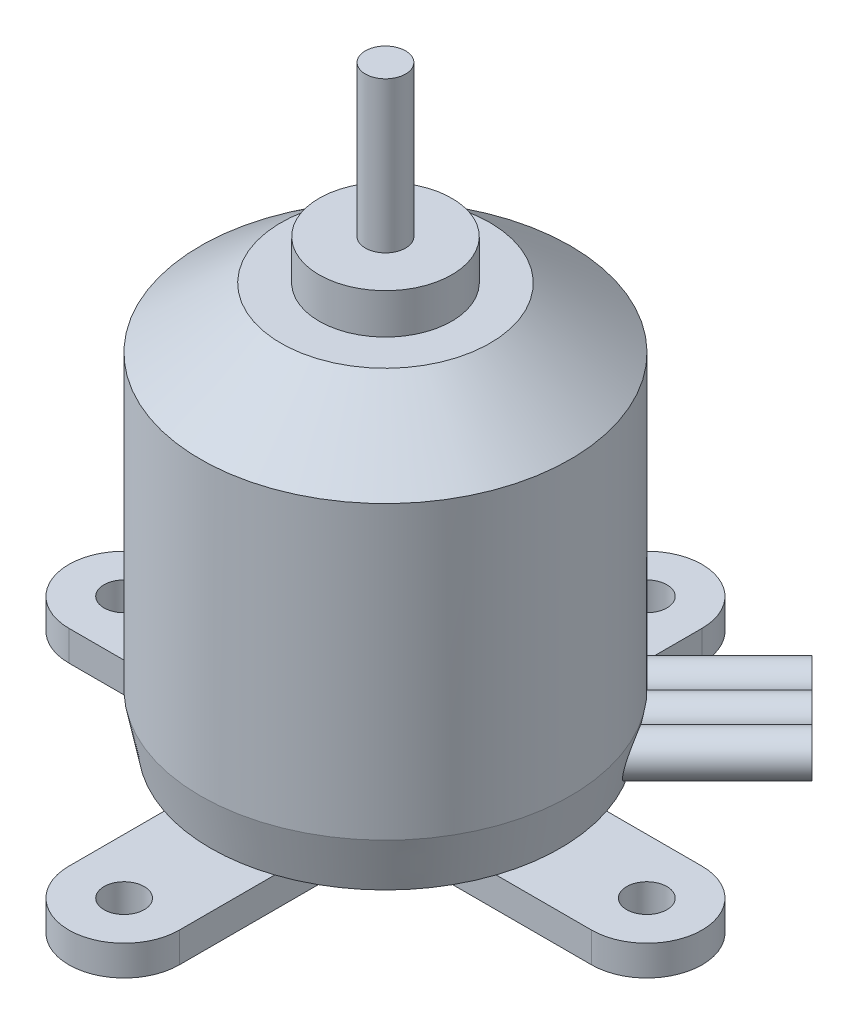
from build123d import *

# Parameters (mm, degrees)
SKETCH1_R           = 9.2
BOSS_EXTRUDE1_DEPTH = 20
CHAMFER1_SIZE       = 3
CHAMFER1_SIZE2      = 4
SKETCH2_R           = 3.3
BOSS_EXTRUDE2_DEPTH = 2
SKETCH3_R           = 1
BOSS_EXTRUDE3_DEPTH = 7.5
CHAMFER2_SIZE       = 0.5
CHAMFER2_SIZE2      = 2.5
SKETCH4_R           = 1
BOSS_EXTRUDE4_DEPTH = 1.5
SKETCH5_R           = 1
BOSS_EXTRUDE5_DEPTH = 15


with BuildPart() as part:
    # Sketch1 → Boss-Extrude1 (new body)
    with BuildSketch(Plane(origin=(0, 0, 0), x_dir=(1, 0, 0), z_dir=(0, 1, 0))):
        with Locations(Location((0, 0, 0), (0, 0, 270))):
            Circle(SKETCH1_R)
    extrude(amount=BOSS_EXTRUDE1_DEPTH)

    # Chamfer1
    chamfer1_edges = [part.edges().sort_by_distance(p)[0] for p in [
        (0, 20, -9.2),
    ]]
    chamfer1_side = [part.faces().sort_by_distance(p)[0] for p in [
        (0, 10, -9.2),
    ]]
    chamfer(chamfer1_edges, length=CHAMFER1_SIZE, length2=CHAMFER1_SIZE2, reference=chamfer1_side[0])

    # Sketch2 → Boss-Extrude2 (add)
    with BuildSketch(Plane(origin=(0, 20, 0), x_dir=(1, 0, 0), z_dir=(0, 1, 0))):
        with Locations(Location((0, 0, 0), (0, 0, 270))):
            Circle(SKETCH2_R)
    extrude(amount=BOSS_EXTRUDE2_DEPTH)

    # Sketch3 → Boss-Extrude3 (add)
    with BuildSketch(Plane(origin=(0, 22, 0), x_dir=(1, 0, 0), z_dir=(0, 1, 0))):
        with Locations(Location((0, 0, 0), (0, 0, 270))):
            Circle(SKETCH3_R)
    extrude(amount=BOSS_EXTRUDE3_DEPTH)

    # Chamfer2
    chamfer2_edges = [part.edges().sort_by_distance(p)[0] for p in [
        (0, 0, -9.2),
    ]]
    chamfer2_side = [part.faces().sort_by_distance(p)[0] for p in [
        (0, 0, 0),
    ]]
    chamfer(chamfer2_edges, length=CHAMFER2_SIZE, length2=CHAMFER2_SIZE2, reference=chamfer2_side[0])

    # Sketch4 → Boss-Extrude4 (add)
    with BuildSketch(Plane.XZ):
        with BuildLine():
            Line((-2.75, 2.75), (-2.75, 13))
            ThreePointArc((-2.75, 13), (0, 15.75), (2.75, 13))
            Line((2.75, 13), (2.75, 2.75))
            Line((2.75, 2.75), (13, 2.75))
            ThreePointArc((13, 2.75), (15.75, 0), (13, -2.75))
            Line((13, -2.75), (2.75, -2.75))
            Line((2.75, -2.75), (2.75, -13))
            ThreePointArc((2.75, -13), (0, -15.75), (-2.75, -13))
            Line((-2.75, -13), (-2.75, -2.75))
            Line((-2.75, -2.75), (-13, -2.75))
            ThreePointArc((-13, -2.75), (-15.75, 0), (-13, 2.75))
            Line((-13, 2.75), (-2.75, 2.75))
        make_face()
        with Locations(Location((0, 13, 0), (0, 0, 270))):
            Circle(SKETCH4_R, mode=Mode.SUBTRACT)
        with Locations(Location((13, 0, 0), (0, 0, 270))):
            Circle(SKETCH4_R, mode=Mode.SUBTRACT)
        with Locations(Location((0, -13, 0), (0, 0, 270))):
            Circle(SKETCH4_R, mode=Mode.SUBTRACT)
        with Locations(Location((-13, 0, 0), (0, 0, 270))):
            Circle(SKETCH4_R, mode=Mode.SUBTRACT)
        with Locations(Location((0, 6.5, 0), (0, 0, 270))):
            Circle(SKETCH4_R, mode=Mode.SUBTRACT)
        with Locations(Location((6.5, 0, 0), (0, 0, 270))):
            Circle(SKETCH4_R, mode=Mode.SUBTRACT)
        with Locations(Location((0, -6.5, 0), (0, 0, 270))):
            Circle(SKETCH4_R, mode=Mode.SUBTRACT)
        with Locations(Location((-6.5, 0, 0), (0, 0, 270))):
            Circle(SKETCH4_R, mode=Mode.SUBTRACT)
    extrude(amount=BOSS_EXTRUDE4_DEPTH)

    # Sketch5 → Boss-Extrude5 (add)
    with BuildSketch(Plane(origin=(0, 0, 0), x_dir=(-0.7071067811865477, 0, -0.7071067811865475), z_dir=(0.7071067811865475, 0, -0.7071067811865477))):
        with Locations(Location((-2.1, 1.25, 0), (0, 0, 330.861265368))):
            Circle(SKETCH5_R)
        with Locations(Location((0, 1.25, 0), (0, 0, 337.716833598))):
            Circle(SKETCH5_R)
        with Locations(Location((2.1, 1.25, 0), (0, 0, 330.024971027))):
            Circle(SKETCH5_R)
    extrude(amount=BOSS_EXTRUDE5_DEPTH)


solid = part.part
